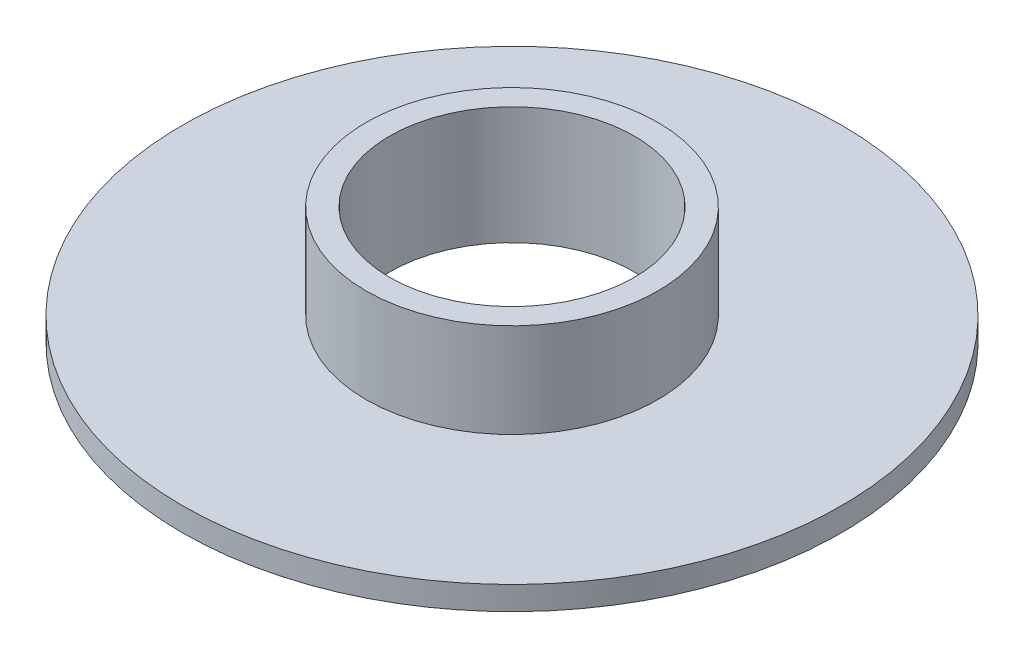
from build123d import *

# Parameters (mm, degrees)
CUT_EXTRUDE1_START = -10
SKETCH3_R          = 26
CUT_EXTRUDE1_DEPTH = 10


with BuildPart() as part:
    # Sketch1 → Revolve1 (revolve)
    with BuildSketch(Plane(origin=(0, 0, 0), x_dir=(0, 0, -1), z_dir=(1, 0, 0)), mode=Mode.PRIVATE) as revolve1_sk:
        Polygon((0, 0), (70, 0), (70, 5), (31, 5), (31, 25), (26, 25), (26, 5), (0, 5), align=None)
    revolve(revolve1_sk.sketch.rotate(Axis((0, 5, 0), (0, -1, 0)), 180), axis=Axis((0, 5, 0), (0, -1, 0)))

    # Sketch3 → Cut-Extrude1 (cut)
    with BuildSketch(Plane(origin=(0, 5, 0), x_dir=(1, 0, 0), z_dir=(0, 1, 0)).offset(CUT_EXTRUDE1_START)):
        with Locations(Location((0, 0, 0), (0, 0, 270))):
            Circle(SKETCH3_R)
    extrude(amount=CUT_EXTRUDE1_DEPTH, mode=Mode.SUBTRACT)


solid = part.part
